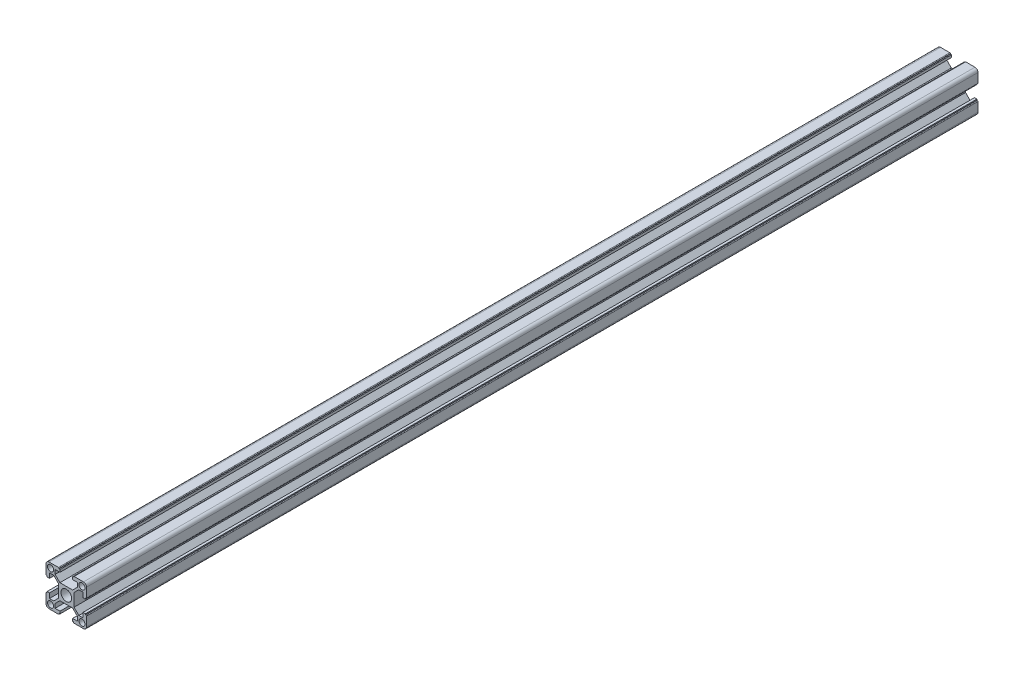
from build123d import *

# Parameters (mm, degrees)
SKETCH_1_R          = 2.65
SKETCH_1_R_2        = 1.5
EXTRUDE_1_DEPTH     = 220
SKETCH_4_R          = 2
CUT_EXTRUDE_3_DEPTH = 221.662236234


with BuildPart() as part:
    # 草图1 → 凸台-拉伸1 (new, symmetric)
    with BuildSketch(Plane.XY):
        with BuildLine():
            Line((3.142893219, 3.85), (-3.142893219, 3.85))
            Line((-3.142893219, 3.85), (-5.5, 6.207106781))
            Line((-5.5, 6.207106781), (-5.5, 8.3))
            Line((-5.5, 8.3), (-3.1, 8.3))
            Line((-3.1, 8.3), (-3.1, 9.5))
            Line((-3.1, 9.5), (-3.6, 9.5))
            Line((-3.6, 9.5), (-3.6, 9.7))
            ThreePointArc((-3.6, 9.7), (-3.687867966, 9.912132034), (-3.9, 10))
            Line((-3.9, 10), (-8.5, 10))
            ThreePointArc((-8.5, 10), (-9.560660172, 9.560660172), (-10, 8.5))
            Line((-10, 8.5), (-10, 3.9))
            ThreePointArc((-10, 3.9), (-9.912132034, 3.687867966), (-9.7, 3.6))
            Line((-9.7, 3.6), (-9.5, 3.6))
            Line((-9.5, 3.6), (-9.5, 3.1))
            Line((-9.5, 3.1), (-8.3, 3.1))
            Line((-8.3, 3.1), (-8.3, 5.5))
            Line((-8.3, 5.5), (-6.207106781, 5.5))
            Line((-6.207106781, 5.5), (-3.85, 3.142893219))
            Line((-3.85, 3.142893219), (-3.85, -3.142893219))
            Line((-3.85, -3.142893219), (-6.207106781, -5.5))
            Line((-6.207106781, -5.5), (-8.3, -5.5))
            Line((-8.3, -5.5), (-8.3, -3.1))
            Line((-8.3, -3.1), (-9.5, -3.1))
            Line((-9.5, -3.1), (-9.5, -3.6))
            Line((-9.5, -3.6), (-9.7, -3.6))
            ThreePointArc((-9.7, -3.6), (-9.912132034, -3.687867966), (-10, -3.9))
            Line((-10, -3.9), (-10, -8.5))
            ThreePointArc((-10, -8.5), (-9.560660172, -9.560660172), (-8.5, -10))
            Line((-8.5, -10), (-3.9, -10))
            ThreePointArc((-3.9, -10), (-3.687867966, -9.912132034), (-3.6, -9.7))
            Line((-3.6, -9.7), (-3.6, -9.5))
            Line((-3.6, -9.5), (-3.1, -9.5))
            Line((-3.1, -9.5), (-3.1, -8.3))
            Line((-3.1, -8.3), (-5.5, -8.3))
            Line((-5.5, -8.3), (-5.5, -6.207106781))
            Line((-5.5, -6.207106781), (-3.142893219, -3.85))
            Line((-3.142893219, -3.85), (3.142893219, -3.85))
            Line((3.142893219, -3.85), (5.5, -6.207106781))
            Line((5.5, -6.207106781), (5.5, -8.3))
            Line((5.5, -8.3), (3.1, -8.3))
            Line((3.1, -8.3), (3.1, -9.5))
            Line((3.1, -9.5), (3.6, -9.5))
            Line((3.6, -9.5), (3.6, -9.7))
            ThreePointArc((3.6, -9.7), (3.687867966, -9.912132034), (3.9, -10))
            Line((3.9, -10), (8.5, -10))
            ThreePointArc((8.5, -10), (9.560660172, -9.560660172), (10, -8.5))
            Line((10, -8.5), (10, -3.9))
            ThreePointArc((10, -3.9), (9.912132034, -3.687867966), (9.7, -3.6))
            Line((9.7, -3.6), (9.5, -3.6))
            Line((9.5, -3.6), (9.5, -3.1))
            Line((9.5, -3.1), (8.3, -3.1))
            Line((8.3, -3.1), (8.3, -5.5))
            Line((8.3, -5.5), (6.207106781, -5.5))
            Line((6.207106781, -5.5), (3.85, -3.142893219))
            Line((3.85, -3.142893219), (3.85, 3.142893219))
            Line((3.85, 3.142893219), (6.207106781, 5.5))
            Line((6.207106781, 5.5), (8.3, 5.5))
            Line((8.3, 5.5), (8.3, 3.1))
            Line((8.3, 3.1), (9.5, 3.1))
            Line((9.5, 3.1), (9.5, 3.6))
            Line((9.5, 3.6), (9.7, 3.6))
            ThreePointArc((9.7, 3.6), (9.912132034, 3.687867966), (10, 3.9))
            Line((10, 3.9), (10, 8.5))
            ThreePointArc((10, 8.5), (9.560660172, 9.560660172), (8.5, 10))
            Line((8.5, 10), (3.9, 10))
            ThreePointArc((3.9, 10), (3.687867966, 9.912132034), (3.6, 9.7))
            Line((3.6, 9.7), (3.6, 9.5))
            Line((3.6, 9.5), (3.1, 9.5))
            Line((3.1, 9.5), (3.1, 8.3))
            Line((3.1, 8.3), (5.5, 8.3))
            Line((5.5, 8.3), (5.5, 6.207106781))
            Line((5.5, 6.207106781), (3.142893219, 3.85))
        make_face()
        Circle(SKETCH_1_R, mode=Mode.SUBTRACT)
        with Locations((-7.75, 7.75)):
            Circle(SKETCH_1_R_2, mode=Mode.SUBTRACT)
        with Locations((7.75, 7.75)):
            Circle(SKETCH_1_R_2, mode=Mode.SUBTRACT)
        with Locations((7.75, -7.75)):
            Circle(SKETCH_1_R_2, mode=Mode.SUBTRACT)
        with Locations((-7.75, -7.75)):
            Circle(SKETCH_1_R_2, mode=Mode.SUBTRACT)
    extrude(amount=EXTRUDE_1_DEPTH, both=True)

    # 草图4 → 切除-拉伸3 (cut, through all)
    with BuildSketch(Plane(origin=(3.85, 0, 0), x_dir=(0, 0, -1), z_dir=(1, 0, 0))):
        with Locations((-210, 0)):
            Circle(SKETCH_4_R)
        with Locations((210, 0)):
            Circle(SKETCH_4_R)
        with Locations((-190, 0)):
            Circle(SKETCH_4_R)
        with Locations((190, 0)):
            Circle(SKETCH_4_R)
        with Locations((-100, 0)):
            Circle(SKETCH_4_R)
        with Locations((100, 0)):
            Circle(SKETCH_4_R)
    extrude(amount=-CUT_EXTRUDE_3_DEPTH, mode=Mode.SUBTRACT)


solid = part.part
